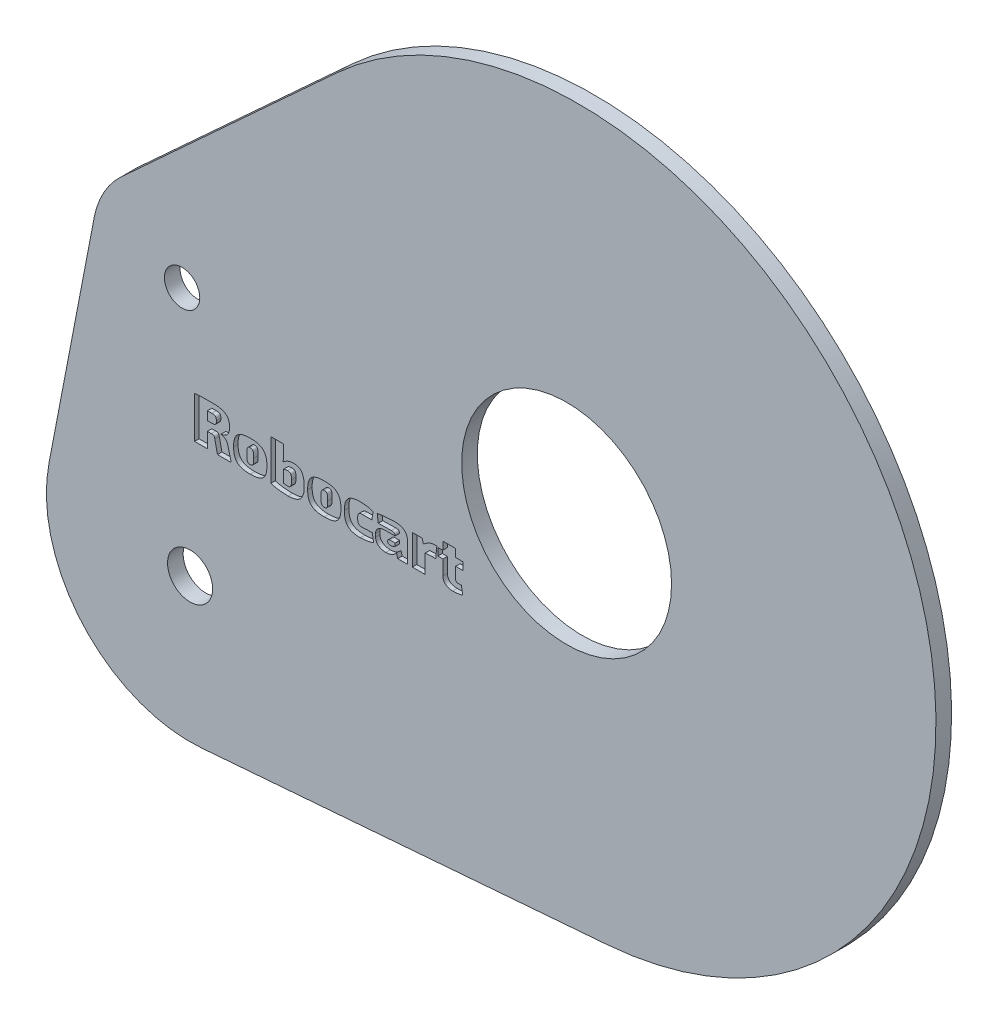
from build123d import *

# Parameters (mm, degrees)
SKETCH1_R           = 5.0254
SKETCH1_R_2         = 3.175
BOSS_EXTRUDE1_DEPTH = 4.445
SKETCH2_R           = 6.4135
BOSS_EXTRUDE2_DEPTH = 4.445
CUT_EXTRUDE5_DEPTH  = 1.27
SKETCH7_R           = 29.845
CUT_EXTRUDE8_DEPTH  = 242.323003135


with BuildPart() as part:
    # Sketch1 → Boss-Extrude1 (new body)
    with BuildSketch(Plane.XY):
        with BuildLine():
            Line((-17.211015945, 18.751241343), (43.963752379, 74.901119305))
            ThreePointArc((43.963752379, 74.901119305), (214.381413502, 0), (43.963752379, -74.901119305))
            Line((43.963752379, -74.901119305), (-17.211015945, -18.751241343))
            ThreePointArc((-17.211015945, -18.751241343), (-25.452467891, 0), (-17.211015945, 18.751241343))
        make_face()
        Circle(SKETCH1_R, mode=Mode.SUBTRACT)
        with Locations((112.7125, 0)):
            Circle(SKETCH1_R_2, mode=Mode.SUBTRACT)
    extrude(amount=BOSS_EXTRUDE1_DEPTH)

    # Sketch2 → Boss-Extrude2 (add)
    with BuildSketch(Plane.XY):
        with BuildLine():
            Line((-24.995388267, 4.801946178), (-37.855905828, -62.140417979))
            ThreePointArc((-37.855905828, -62.140417979), (-28.163364792, -97.115789925), (5.538841954, -110.583650001))
            Line((5.538841954, -110.583650001), (120.834104773, -101.344005785))
            ThreePointArc((120.834104773, -101.344005785), (79.641074663, -96.139735796), (43.963752379, -74.901119305))
            Line((43.963752379, -74.901119305), (-17.211015945, -18.751241343))
            ThreePointArc((-17.211015945, -18.751241343), (-24.166780914, -7.987166081), (-24.995388267, 4.801946178))
        make_face()
        with Locations((2.274488984, -69.85)):
            Circle(SKETCH2_R, mode=Mode.SUBTRACT)
    extrude(amount=BOSS_EXTRUDE2_DEPTH)

    # Sketch5 → Cut-Extrude5 (cut)
    # profile 1 of 8: a face of its own
    with BuildSketch(Plane.XY.offset(4.445)):
        with BuildLine():
            Line((13.963704332, -36.057605806), (13.037614354, -32.449309188))
            add(Edge.make_bspline(
                [(13.037614354, -32.449309188), (13.014990571, -32.365644285), (12.971064629, -32.203201971), (12.896536125, -31.970161677), (12.806221588, -31.759183753), (12.708280407, -31.566790267), (12.596656769, -31.39709784), (12.478234261, -31.245551793), (12.345653753, -31.11867894), (12.160105674, -30.980245842), (11.921747748, -30.846153242), (11.640556459, -30.716510915), (11.365581075, -30.628104271), (11.181578474, -30.606425076), (11.092818152, -30.59596733)],
                knots=[0, 0, 0, 0, 1.077305702, 2.091677954, 3.037688743, 3.926929695, 4.771153773, 5.558605575, 6.312393956, 7.044123723, 8.430977119, 9.701515358, 10.89124264, 12, 12, 12, 12], degree=3))
            Line((11.092818152, -30.59596733), (11.093852026, -30.490707873))
            add(Edge.make_bspline(
                [(11.093852026, -30.490707873), (11.202590701, -30.475351692), (11.413544088, -30.445560652), (11.716001273, -30.377632832), (11.991876474, -30.285100292), (12.242847632, -30.176293564), (12.471067847, -30.051620567), (12.669266098, -29.90083579), (12.845338876, -29.735309335), (12.99145185, -29.547434621), (13.112604312, -29.345503098), (13.224948415, -29.137740289), (13.311060145, -28.916416469), (13.388184538, -28.68792999), (13.440911923, -28.448026662), (13.477314381, -28.199186394), (13.501750709, -27.941486191), (13.500324263, -27.766261913), (13.499598898, -27.677158204)],
                knots=[0, 0, 0, 0, 1.26978194, 2.463381128, 3.579096605, 4.629624065, 5.624356077, 6.577924219, 7.501901734, 8.4118476, 9.319542298, 10.223774319, 11.139249399, 12.061995962, 13.010448794, 13.974684905, 14.970102261, 16, 16, 16, 16], degree=3))
            add(Edge.make_bspline(
                [(13.499598898, -27.677158204), (13.497779323, -27.51291216), (13.494275187, -27.196607345), (13.438886003, -26.74186203), (13.348357528, -26.325529583), (13.221174047, -25.946373662), (13.052132351, -25.606658347), (12.844529179, -25.306163557), (12.600414942, -25.042265619), (12.312565127, -24.820638192), (11.985902071, -24.631404835), (11.617145926, -24.470697822), (11.204967827, -24.340580285), (10.75300819, -24.226744159), (10.256133309, -24.148648607), (9.717084542, -24.091653462), (9.134898017, -24.062842929), (8.733060441, -24.063128866), (8.525255548, -24.063276735)],
                knots=[0, 0, 0, 0, 1.104208727, 2.126483719, 3.075171058, 3.966171587, 4.809496057, 5.618738063, 6.415337279, 7.217477855, 8.052665404, 8.949189943, 9.917359153, 10.957177015, 12.081428767, 13.297225691, 14.602296653, 16, 16, 16, 16], degree=3))
            add(Edge.make_bspline(
                [(8.525255548, -24.063276735), (8.256459134, -24.062794687), (7.743596603, -24.06187494), (7.013077477, -24.068064036), (6.359145049, -24.073281532), (5.587169315, -24.093866835), (4.661777333, -24.134626761), (3.930813591, -24.200571992), (3.560806466, -24.233952862)],
                knots=[0, 0, 0, 0, 0.973558164, 1.857545264, 2.645999097, 3.342055079, 4.654572721, 6, 6, 6, 6], degree=3))
            Line((3.560806466, -24.233952862), (3.563277617, -36.057605806))
            Line((3.563277617, -36.057605806), (7.184582203, -36.057605806))
            Line((7.184582203, -36.057605806), (7.184582203, -31.768440531))
            Line((7.184582203, -31.768440531), (8.30891747, -31.768440531))
            add(Edge.make_bspline(
                [(8.30891747, -31.768440531), (8.380261755, -31.769369764), (8.513302565, -31.771102573), (8.700281908, -31.796279287), (8.856873741, -31.847706403), (8.99055896, -31.921151927), (9.095389594, -32.032855265), (9.182529606, -32.177565891), (9.249964241, -32.360968219), (9.280570623, -32.496879584), (9.297008469, -32.569873841)],
                knots=[0, 0, 0, 0, 1.193247076, 2.225133473, 3.141087189, 3.938333415, 4.747893053, 5.670469204, 6.74887306, 8, 8, 8, 8], degree=3))
            Line((9.297008469, -32.569873841), (10.061765834, -36.057605806))
            Line((10.061765834, -36.057605806), (13.963704332, -36.057605806))
        make_face()
        with BuildLine():
            Line((7.184582203, -29.126668499), (7.184582203, -26.702577615))
            Line((7.184582203, -26.702577615), (8.443166457, -26.702577615))
            add(Edge.make_bspline(
                [(8.443166457, -26.702577615), (8.55974947, -26.702835759), (8.774857139, -26.703312062), (9.069245607, -26.746786171), (9.307824191, -26.818815143), (9.495289883, -26.934320456), (9.622357546, -27.10757662), (9.705012968, -27.329239872), (9.749194089, -27.60532945), (9.749503166, -27.807276716), (9.749671241, -27.917094208)],
                knots=[0, 0, 0, 0, 1.314294372, 2.425008512, 3.346034536, 4.11257004, 4.862605474, 5.723121957, 6.761849854, 8, 8, 8, 8], degree=3))
            add(Edge.make_bspline(
                [(9.749671241, -27.917094208), (9.749462678, -28.026085366), (9.749077821, -28.227205123), (9.705009978, -28.502474206), (9.622358211, -28.724139888), (9.495289599, -28.897389134), (9.307824756, -29.012921602), (9.069243039, -29.084819613), (8.774224153, -29.129036801), (8.558415428, -29.127502287), (8.441154268, -29.126668499)],
                knots=[0, 0, 0, 0, 1.229150822, 2.268133684, 3.128861388, 3.879080924, 4.645804581, 5.567056679, 6.678043453, 8, 8, 8, 8], degree=3))
            Line((8.441154268, -29.126668499), (7.184582203, -29.126668499))
        make_face(mode=Mode.SUBTRACT)
    # profile 2 of 8: a face of its own
    with BuildSketch(Plane.XY.offset(4.445)):
        with BuildLine():
            add(Edge.make_bspline(
                [(19.392408615, -27.370438305), (19.185940731, -27.37121647), (18.788443795, -27.372714613), (18.214825083, -27.415394013), (17.686058795, -27.487157041), (17.20268726, -27.59542077), (16.76459492, -27.735119832), (16.372638511, -27.908622648), (16.024579804, -28.114088335), (15.720673057, -28.356552609), (15.458507791, -28.639434381), (15.234998101, -28.964856165), (15.046260918, -29.333899032), (14.896720781, -29.748269807), (14.781171023, -30.20574699), (14.701460929, -30.707355794), (14.653402971, -31.252980669), (14.652664325, -31.631462891), (14.652281146, -31.827803724)],
                knots=[0, 0, 0, 0, 1.301138732, 2.504983567, 3.622955002, 4.661926955, 5.623444867, 6.516867694, 7.358299959, 8.164315082, 8.958683684, 9.780463849, 10.645170289, 11.564345272, 12.55137133, 13.615162501, 14.76284551, 16, 16, 16, 16], degree=3))
            add(Edge.make_bspline(
                [(14.652281146, -31.827803724), (14.652683844, -32.020846667), (14.653461359, -32.393566713), (14.701421784, -32.930979582), (14.781161162, -33.425184288), (14.896568533, -33.875369171), (15.046865454, -34.282830679), (15.23482084, -34.646579128), (15.459495784, -34.966867972), (15.719799454, -35.24761051), (16.026355063, -35.483959428), (16.371844156, -35.690792822), (16.764905901, -35.860835683), (17.202769513, -35.998315896), (17.686174729, -36.104237626), (18.215025172, -36.172549933), (18.788142548, -36.21690631), (19.185414172, -36.216251559), (19.391635626, -36.215911682)],
                knots=[0, 0, 0, 0, 1.225303258, 2.365769401, 3.421876917, 4.400943223, 5.312143672, 6.173900677, 6.993129972, 7.789505327, 8.594933318, 9.442546689, 10.340413257, 11.307394121, 12.352858382, 13.478324105, 14.691012305, 16, 16, 16, 16], degree=3))
            add(Edge.make_bspline(
                [(19.391635626, -36.215911682), (19.597032745, -36.216251945), (19.992657844, -36.216907342), (20.563309426, -36.172565441), (21.089688433, -36.104227613), (21.570666185, -35.998406236), (22.00669053, -35.860378726), (22.398966428, -35.690697968), (22.744357702, -35.48476242), (23.048799976, -35.246752683), (23.30884749, -34.966889154), (23.53405161, -34.647213564), (23.718480818, -34.282096079), (23.869607615, -33.875481435), (23.984729298, -33.425150679), (24.064554181, -32.930989632), (24.112489404, -32.393563896), (24.113270555, -32.020845706), (24.113675136, -31.827803724)],
                knots=[0, 0, 0, 0, 1.306386535, 2.516292846, 3.638834432, 4.681288433, 5.645225056, 6.544905627, 7.394231473, 8.197166916, 8.995151228, 9.816035651, 10.677123946, 11.590165338, 12.571209699, 13.62945092, 14.772221202, 16, 16, 16, 16], degree=3))
            add(Edge.make_bspline(
                [(24.113675136, -31.827803724), (24.113290046, -31.631463854), (24.112547717, -31.252983486), (24.064515237, -30.707345781), (23.984718669, -30.205780525), (23.869458196, -29.748157657), (23.719073032, -29.334629822), (23.533881557, -28.964226762), (23.309838836, -28.639410514), (23.047913464, -28.357409293), (22.746143109, -28.113290896), (22.398170175, -27.908717581), (22.006996305, -27.735582548), (21.570750122, -27.595337595), (21.089805172, -27.487132059), (20.563508471, -27.415524751), (19.992633712, -27.372122206), (19.597024498, -27.372640416), (19.391635626, -27.372909456)],
                knots=[0, 0, 0, 0, 1.239761575, 2.389863124, 3.455896047, 4.445002089, 5.366114071, 6.230275951, 7.053787873, 7.849830466, 8.653486971, 9.496692405, 10.391997964, 11.35058848, 12.386669903, 13.50184006, 14.703027546, 16, 16, 16, 16], degree=3))
            Line((19.391635626, -27.372909456), (19.392408615, -27.370438305))
        make_face()
        with BuildLine():
            add(Edge.make_bspline(
                [(19.392408615, -29.725274142), (19.437531289, -29.724140714), (19.525024289, -29.721942995), (19.65102649, -29.737238192), (19.76620368, -29.76483225), (19.87182592, -29.802109335), (19.962537582, -29.861963333), (20.042092672, -29.933543699), (20.109942403, -30.020017857), (20.16833225, -30.121266804), (20.214599448, -30.244431568), (20.257437224, -30.390375107), (20.286756888, -30.564903306), (20.314974666, -30.765182064), (20.332768493, -30.993196759), (20.349156064, -31.24710558), (20.352028087, -31.528505382), (20.351602926, -31.724744581), (20.351379644, -31.827803724)],
                knots=[0, 0, 0, 0, 0.815282387, 1.580835021, 2.285938702, 2.955970902, 3.59284183, 4.236654335, 4.883909712, 5.571782011, 6.34138828, 7.256745613, 8.318150629, 9.536784446, 10.913497992, 12.451627213, 14.136497401, 16, 16, 16, 16], degree=3))
            add(Edge.make_bspline(
                [(20.351379644, -31.827803724), (20.35159955, -31.927564515), (20.352019405, -32.118031924), (20.34917368, -32.391195088), (20.332779722, -32.637680018), (20.315073621, -32.858305107), (20.286553348, -33.051939542), (20.257596079, -33.220793633), (20.214257509, -33.362529917), (20.155693628, -33.514911844), (20.051090018, -33.669923267), (19.870735609, -33.798425844), (19.643452754, -33.865218315), (19.479445068, -33.862520337), (19.391635626, -33.861075845)],
                knots=[0, 0, 0, 0, 1.385054146, 2.644402385, 3.791133793, 4.814000026, 5.715679688, 6.508153822, 7.189017703, 7.76931152, 8.772713745, 9.732124418, 10.785783184, 12, 12, 12, 12], degree=3))
            add(Edge.make_bspline(
                [(19.391635626, -33.861075845), (19.301306425, -33.86271431), (19.133954745, -33.865749872), (18.902525901, -33.797741478), (18.717735707, -33.671072511), (18.610582928, -33.515364885), (18.551006939, -33.362942633), (18.512459098, -33.219990413), (18.478046172, -33.052393011), (18.451529414, -32.858200063), (18.432071348, -32.637802884), (18.421098431, -32.391048348), (18.412685119, -32.118090951), (18.413926504, -31.927578365), (18.414576639, -31.827803724)],
                knots=[0, 0, 0, 0, 1.241376632, 2.299881571, 3.272351116, 4.276537072, 4.853504633, 5.527301281, 6.317449116, 7.213960333, 8.230963477, 9.370496789, 10.622885011, 12, 12, 12, 12], degree=3))
            add(Edge.make_bspline(
                [(18.414576639, -31.827803724), (18.413920098, -31.724731001), (18.412669836, -31.528447706), (18.421114928, -31.247248307), (18.432075612, -30.993076145), (18.451640516, -30.765288151), (18.477809436, -30.564450024), (18.512677464, -30.391184595), (18.550528138, -30.243947504), (18.597992213, -30.121472778), (18.655635922, -30.019044712), (18.726640856, -29.934548542), (18.806324672, -29.86014789), (18.90084365, -29.803586909), (19.007720237, -29.76410688), (19.124926082, -29.737543648), (19.254377699, -29.721206538), (19.344600366, -29.725504607), (19.391635626, -29.727745294)],
                knots=[0, 0, 0, 0, 1.852277897, 3.527327117, 5.055401374, 6.423822364, 7.635115809, 8.692933536, 9.598786439, 10.363757028, 11.047485967, 11.700160994, 12.340095531, 12.998298253, 13.664294552, 14.379571275, 15.155231305, 16, 16, 16, 16], degree=3))
            Line((19.391635626, -29.727745294), (19.392408615, -29.725274142))
        make_face(mode=Mode.SUBTRACT)
    # profile 3 of 8: a face of its own
    with BuildSketch(Plane.XY.offset(4.445)):
        with BuildLine():
            Line((28.85797675, -24.045964181), (25.266354969, -24.045964181))
            Line((25.266354969, -24.045964181), (25.266354969, -35.514452512))
            add(Edge.make_bspline(
                [(25.266354969, -35.514452512), (25.33774682, -35.545467337), (25.486176503, -35.609949777), (25.724338862, -35.693194207), (25.98408074, -35.76865646), (26.262717846, -35.840498934), (26.56136332, -35.905161356), (26.880959563, -35.960891414), (27.220596376, -36.013233723), (27.692261258, -36.070319552), (28.271926605, -36.127474027), (28.937324543, -36.180717163), (29.553550952, -36.21253418), (29.947962267, -36.21481811), (30.136810918, -36.215911682)],
                knots=[0, 0, 0, 0, 0.566143425, 1.17705996, 1.833791331, 2.533600597, 3.270136108, 4.056160048, 4.893498106, 5.769972827, 7.512277332, 9.130813025, 10.626200442, 12, 12, 12, 12], degree=3))
            add(Edge.make_bspline(
                [(30.136810918, -36.215911682), (30.253120421, -36.212831969), (30.481025042, -36.206797375), (30.814116882, -36.180351265), (31.132628194, -36.148829369), (31.435926278, -36.108441573), (31.724065643, -36.051908895), (31.997843415, -35.992040435), (32.256210542, -35.91986874), (32.499003227, -35.838292685), (32.727794574, -35.747533842), (32.939448091, -35.643456076), (33.136885285, -35.531157057), (33.320096393, -35.411444435), (33.486668107, -35.278254108), (33.640625141, -35.138671251), (33.777483607, -34.986492799), (33.937767113, -34.771179967), (34.113879784, -34.488036121), (34.294341823, -34.133196268), (34.447119214, -33.765794756), (34.564998476, -33.382831094), (34.65496768, -32.986863978), (34.710398877, -32.576353497), (34.739719244, -32.153036178), (34.731776168, -31.866585988), (34.727751374, -31.721440341)],
                knots=[0, 0, 0, 0, 1.127999254, 2.210277188, 3.238897676, 4.23162696, 5.17557524, 6.085246793, 6.948444366, 7.775179884, 8.56797293, 9.333154585, 10.060037587, 10.769610838, 11.452607753, 12.125943687, 12.782602808, 13.433395291, 14.726629494, 16.010264116, 17.290083694, 18.579729525, 19.890904527, 21.222829017, 22.592794515, 24, 24, 24, 24], degree=3))
            add(Edge.make_bspline(
                [(34.727751374, -31.721440341), (34.727933299, -31.536718239), (34.728284429, -31.180190099), (34.699184003, -30.664769561), (34.643331299, -30.188802796), (34.573863297, -29.750232724), (34.469587637, -29.352865417), (34.352130307, -28.992447141), (34.204755582, -28.672388477), (34.034267402, -28.389214863), (33.833226005, -28.142238077), (33.601722543, -27.930169453), (33.337174347, -27.753584651), (33.044251025, -27.605258106), (32.715597337, -27.499208813), (32.358146924, -27.419103488), (31.968334791, -27.375581811), (31.698556174, -27.372189381), (31.559111975, -27.370435889)],
                knots=[0, 0, 0, 0, 1.421889281, 2.744357793, 3.971045822, 5.110570847, 6.158979495, 7.130494519, 8.025127154, 8.865537539, 9.668536019, 10.468266483, 11.27281888, 12.110227575, 12.987396072, 13.923728139, 14.926808692, 16, 16, 16, 16], degree=3))
            add(Edge.make_bspline(
                [(31.559111975, -27.370435889), (31.418641204, -27.377290653), (31.140084953, -27.390883782), (30.728616209, -27.464875676), (30.329554514, -27.580548152), (29.947501678, -27.741160167), (29.584829673, -27.927749873), (29.24432769, -28.134731264), (28.925819878, -28.355544927), (28.731396999, -28.52069247), (28.635355715, -28.602272283)],
                knots=[0, 0, 0, 0, 1.041431214, 2.065178201, 3.090091768, 4.114841366, 5.131524032, 6.110368693, 7.066557293, 8, 8, 8, 8], degree=3))
            add(Edge.make_bspline(
                [(28.635355715, -28.602272283), (28.679442374, -28.437175357), (28.767969322, -28.105657221), (28.849479342, -27.592991808), (28.896352505, -27.067100389), (28.893865391, -26.71174055), (28.892606689, -26.531896657)],
                knots=[0, 0, 0, 0, 0.978525379, 1.96489976, 2.970057081, 4, 4, 4, 4], degree=3))
            Line((28.892606689, -26.531896657), (28.85797675, -24.045964181))
        make_face()
        with BuildLine():
            add(Edge.make_bspline(
                [(28.85797675, -30.2598859), (28.938164933, -30.228940975), (29.104665913, -30.164687614), (29.377050817, -30.104325797), (29.674368967, -30.057331397), (29.8826484, -30.048796574), (29.990870462, -30.044361877)],
                knots=[0, 0, 0, 0, 0.888373905, 1.844600052, 2.880053484, 4, 4, 4, 4], degree=3))
            add(Edge.make_bspline(
                [(29.990870462, -30.044361877), (30.090154356, -30.043598185), (30.274287887, -30.04218183), (30.527813382, -30.099026489), (30.737205354, -30.19921343), (30.864952608, -30.333576514), (30.941281231, -30.464225448), (30.989420661, -30.585258272), (31.027872641, -30.727413399), (31.060247012, -30.890209447), (31.083691262, -31.0745416), (31.101568749, -31.280805556), (31.107864209, -31.508677969), (31.10693523, -31.667848007), (31.106449204, -31.751123146)],
                knots=[0, 0, 0, 0, 1.480574637, 2.745897867, 3.854410053, 4.900898594, 5.459220732, 6.111846885, 6.841895749, 7.659301981, 8.592332102, 9.619461279, 10.75454141, 12, 12, 12, 12], degree=3))
            add(Edge.make_bspline(
                [(31.106449204, -31.751123146), (31.10587886, -31.85088874), (31.104785136, -32.042205133), (31.099203337, -32.316196797), (31.08137277, -32.564522478), (31.057260162, -32.7874112), (31.026051856, -32.984988562), (30.98671092, -33.156994563), (30.941202348, -33.303431436), (30.870052532, -33.460932897), (30.752629333, -33.623379885), (30.561916019, -33.764163367), (30.326364118, -33.848483391), (30.155689552, -33.856708884), (30.065077473, -33.861075845)],
                knots=[0, 0, 0, 0, 1.341428161, 2.572401811, 3.683694972, 4.687557271, 5.586054722, 6.371270954, 7.058412011, 7.643759289, 8.690296819, 9.712417619, 10.785509759, 12, 12, 12, 12], degree=3))
            add(Edge.make_bspline(
                [(30.065077473, -33.861075845), (29.981058258, -33.848086833), (29.796152635, -33.819501215), (29.501179908, -33.788497905), (29.182666077, -33.755491625), (28.965965097, -33.730208343), (28.85797675, -33.717608955)],
                knots=[0, 0, 0, 0, 0.839061258, 1.84656741, 2.926882437, 4, 4, 4, 4], degree=3))
            Line((28.85797675, -33.717608955), (28.85797675, -30.2598859))
        make_face(mode=Mode.SUBTRACT)
    # profile 4 of 8: a face of its own
    with BuildSketch(Plane.XY.offset(4.445)):
        with BuildLine():
            add(Edge.make_bspline(
                [(40.447411398, -27.370438305), (40.240943513, -27.37121647), (39.843446578, -27.372714613), (39.269827865, -27.415394013), (38.741061578, -27.487157041), (38.257690043, -27.59542077), (37.819597703, -27.735119832), (37.427641293, -27.908622648), (37.079582586, -28.114088335), (36.775675839, -28.356552609), (36.513510574, -28.639434381), (36.290000883, -28.964856165), (36.101263701, -29.333899032), (35.951723564, -29.748269807), (35.836173805, -30.20574699), (35.756463711, -30.707355794), (35.708405753, -31.252980669), (35.707667107, -31.631462891), (35.707283928, -31.827803724)],
                knots=[0, 0, 0, 0, 1.301138732, 2.504983567, 3.622955002, 4.661926955, 5.623444867, 6.516867694, 7.358299959, 8.164315082, 8.958683684, 9.780463849, 10.645170289, 11.564345272, 12.55137133, 13.615162501, 14.76284551, 16, 16, 16, 16], degree=3))
            add(Edge.make_bspline(
                [(35.707283928, -31.827803724), (35.707686627, -32.020846667), (35.708464141, -32.393566713), (35.756424567, -32.930979582), (35.836163945, -33.425184288), (35.951571315, -33.875369171), (36.101868237, -34.282830679), (36.289823623, -34.646579128), (36.514498566, -34.966867972), (36.774802237, -35.24761051), (37.081357845, -35.483959428), (37.426846938, -35.690792822), (37.819908684, -35.860835683), (38.257772296, -35.998315896), (38.741177511, -36.104237626), (39.270027954, -36.172549933), (39.84314533, -36.21690631), (40.240416955, -36.216251559), (40.446638408, -36.215911682)],
                knots=[0, 0, 0, 0, 1.225303258, 2.365769401, 3.421876917, 4.400943223, 5.312143672, 6.173900677, 6.993129972, 7.789505327, 8.594933318, 9.442546689, 10.340413257, 11.307394121, 12.352858382, 13.478324105, 14.691012305, 16, 16, 16, 16], degree=3))
            add(Edge.make_bspline(
                [(40.446638408, -36.215911682), (40.652035527, -36.216251945), (41.047660626, -36.216907342), (41.618312209, -36.172565441), (42.144691215, -36.104227613), (42.625668967, -35.998406236), (43.061693313, -35.860378726), (43.45396921, -35.690697968), (43.799360485, -35.48476242), (44.103802758, -35.246752683), (44.363850273, -34.966889154), (44.589054393, -34.647213564), (44.7734836, -34.282096079), (44.924610397, -33.875481435), (45.039732081, -33.425150679), (45.119556963, -32.930989632), (45.167492187, -32.393563896), (45.168273337, -32.020845706), (45.168677918, -31.827803724)],
                knots=[0, 0, 0, 0, 1.306386535, 2.516292846, 3.638834432, 4.681288433, 5.645225056, 6.544905627, 7.394231473, 8.197166916, 8.995151228, 9.816035651, 10.677123946, 11.590165338, 12.571209699, 13.62945092, 14.772221202, 16, 16, 16, 16], degree=3))
            add(Edge.make_bspline(
                [(45.168677918, -31.827803724), (45.168292829, -31.631463854), (45.167550499, -31.252983486), (45.119518019, -30.707345781), (45.039721451, -30.205780525), (44.924460978, -29.748157657), (44.774075814, -29.334629822), (44.588884339, -28.964226762), (44.364841618, -28.639410514), (44.102916246, -28.357409293), (43.801145891, -28.113290896), (43.453172958, -27.908717581), (43.061999088, -27.735582548), (42.625752905, -27.595337595), (42.144807955, -27.487132059), (41.618511254, -27.415524751), (41.047636495, -27.372122206), (40.652027281, -27.372640416), (40.446638408, -27.372909456)],
                knots=[0, 0, 0, 0, 1.239761575, 2.389863124, 3.455896047, 4.445002089, 5.366114071, 6.230275951, 7.053787873, 7.849830466, 8.653486971, 9.496692405, 10.391997964, 11.35058848, 12.386669903, 13.50184006, 14.703027546, 16, 16, 16, 16], degree=3))
            Line((40.446638408, -27.372909456), (40.447411398, -27.370438305))
        make_face()
        with BuildLine():
            add(Edge.make_bspline(
                [(40.447411398, -29.725274142), (40.492534071, -29.724140714), (40.580027071, -29.721942995), (40.706029272, -29.737238192), (40.821206463, -29.76483225), (40.926828703, -29.802109335), (41.017540364, -29.861963333), (41.097095455, -29.933543699), (41.164945186, -30.020017857), (41.223335033, -30.121266804), (41.26960223, -30.244431568), (41.312440007, -30.390375107), (41.341759671, -30.564903306), (41.369977448, -30.765182064), (41.387771276, -30.993196759), (41.404158847, -31.24710558), (41.407030869, -31.528505382), (41.406605708, -31.724744581), (41.406382426, -31.827803724)],
                knots=[0, 0, 0, 0, 0.815282387, 1.580835021, 2.285938702, 2.955970902, 3.59284183, 4.236654335, 4.883909712, 5.571782011, 6.34138828, 7.256745613, 8.318150629, 9.536784446, 10.913497992, 12.451627213, 14.136497401, 16, 16, 16, 16], degree=3))
            add(Edge.make_bspline(
                [(41.406382426, -31.827803724), (41.406602333, -31.927564515), (41.407022188, -32.118031924), (41.404176462, -32.391195088), (41.387782505, -32.637680018), (41.370076403, -32.858305107), (41.34155613, -33.051939542), (41.312598861, -33.220793633), (41.269260291, -33.362529917), (41.210696411, -33.514911844), (41.1060928, -33.669923267), (40.925738391, -33.798425844), (40.698455536, -33.865218315), (40.53444785, -33.862520337), (40.446638408, -33.861075845)],
                knots=[0, 0, 0, 0, 1.385054146, 2.644402385, 3.791133793, 4.814000026, 5.715679688, 6.508153822, 7.189017703, 7.76931152, 8.772713745, 9.732124418, 10.785783184, 12, 12, 12, 12], degree=3))
            add(Edge.make_bspline(
                [(40.446638408, -33.861075845), (40.356309207, -33.86271431), (40.188957528, -33.865749872), (39.957528684, -33.797741478), (39.77273849, -33.671072511), (39.665585711, -33.515364885), (39.606009722, -33.362942633), (39.56746188, -33.219990413), (39.533048954, -33.052393011), (39.506532197, -32.858200063), (39.48707413, -32.637802884), (39.476101213, -32.391048348), (39.467687902, -32.118090951), (39.468929287, -31.927578365), (39.469579421, -31.827803724)],
                knots=[0, 0, 0, 0, 1.241376632, 2.299881571, 3.272351116, 4.276537072, 4.853504633, 5.527301281, 6.317449116, 7.213960333, 8.230963477, 9.370496789, 10.622885011, 12, 12, 12, 12], degree=3))
            add(Edge.make_bspline(
                [(39.469579421, -31.827803724), (39.46892288, -31.724731001), (39.467672618, -31.528447706), (39.47611771, -31.247248307), (39.487078394, -30.993076145), (39.506643298, -30.765288151), (39.532812219, -30.564450024), (39.567680246, -30.391184595), (39.60553092, -30.243947504), (39.652994995, -30.121472778), (39.710638704, -30.019044712), (39.781643638, -29.934548542), (39.861327454, -29.86014789), (39.955846432, -29.803586909), (40.062723019, -29.76410688), (40.179928865, -29.737543648), (40.309380481, -29.721206538), (40.399603149, -29.725504607), (40.446638408, -29.727745294)],
                knots=[0, 0, 0, 0, 1.852277897, 3.527327117, 5.055401374, 6.423822364, 7.635115809, 8.692933536, 9.598786439, 10.363757028, 11.047485967, 11.700160994, 12.340095531, 12.998298253, 13.664294552, 14.379571275, 15.155231305, 16, 16, 16, 16], degree=3))
            Line((40.446638408, -29.727745294), (40.447411398, -29.725274142))
        make_face(mode=Mode.SUBTRACT)
    # profile 5 of 8: a face of its own
    with BuildSketch(Plane.XY.offset(4.445)):
        with BuildLine():
            add(Edge.make_bspline(
                [(54.107651647, -33.27059384), (53.84002184, -33.295782752), (53.320082329, -33.34471867), (52.68112121, -33.37225006), (52.205166116, -33.380840506), (51.889380831, -33.387333455), (51.609020319, -33.38591113), (51.434222733, -33.386074622), (51.352595559, -33.38615097)],
                knots=[0, 0, 0, 0, 1.753605035, 3.406827339, 4.170886547, 4.859546372, 5.467429674, 6, 6, 6, 6], degree=3))
            add(Edge.make_bspline(
                [(51.352595559, -33.38615097), (51.288257908, -33.38713718), (51.16356574, -33.389048545), (50.984334545, -33.375792096), (50.819386497, -33.355069779), (50.670634076, -33.31978455), (50.535596795, -33.276326421), (50.416645239, -33.219662393), (50.312693678, -33.151350016), (50.22172405, -33.072044846), (50.145642956, -32.974241984), (50.082316443, -32.85944643), (50.026729874, -32.727142095), (49.987082558, -32.574337651), (49.951236144, -32.404602196), (49.930675405, -32.214941417), (49.918001023, -32.006911113), (49.917952178, -31.861632316), (49.917926666, -31.785753084)],
                knots=[0, 0, 0, 0, 1.209474384, 2.344070404, 3.376943074, 4.332298939, 5.214920591, 6.040246273, 6.80146698, 7.548338784, 8.299063779, 9.118395519, 10.008206862, 10.990122684, 12.081843351, 13.268539912, 14.5733562, 16, 16, 16, 16], degree=3))
            add(Edge.make_bspline(
                [(49.917926666, -31.785753084), (49.917954701, -31.711522008), (49.918008636, -31.568713514), (49.930838903, -31.363172194), (49.951019745, -31.17511603), (49.986940058, -31.006982105), (50.027327574, -30.856121136), (50.081545611, -30.724818417), (50.146419747, -30.611726083), (50.221636998, -30.514251149), (50.312719782, -30.435022254), (50.416628092, -30.366635916), (50.535641772, -30.310212928), (50.670283042, -30.265828251), (50.819778089, -30.234668666), (50.984269823, -30.212741839), (51.163583844, -30.199852929), (51.28826407, -30.201711301), (51.352595559, -30.202670168)],
                knots=[0, 0, 0, 0, 1.403834989, 2.700749752, 3.89441997, 4.977274868, 5.949945309, 6.844985653, 7.655590205, 8.410726857, 9.161987675, 9.927681717, 10.757857448, 11.645665852, 12.603212224, 13.6421546, 14.783418105, 16, 16, 16, 16], degree=3))
            Line((51.352595559, -30.202670168), (53.953773553, -30.200199017))
            Line((53.953773553, -30.200199017), (54.31282244, -27.997299137))
            add(Edge.make_bspline(
                [(54.31282244, -27.997299137), (54.176091179, -27.940521737), (53.899388106, -27.825621304), (53.463544379, -27.688107836), (53.006733558, -27.576308959), (52.53319341, -27.498107556), (52.05997885, -27.440868548), (51.600631964, -27.397572295), (51.162379139, -27.374638478), (50.877693617, -27.373475447), (50.739150929, -27.372909456)],
                knots=[0, 0, 0, 0, 0.972227876, 1.967497694, 2.99880285, 4.059393783, 5.118240435, 6.129942292, 7.08993327, 8, 8, 8, 8], degree=3))
            add(Edge.make_bspline(
                [(50.739150929, -27.372909456), (50.538710802, -27.373727885), (50.151351778, -27.375309535), (49.592801842, -27.41775067), (49.078690327, -27.489141999), (48.610409709, -27.598614086), (48.186003206, -27.737439815), (47.80638156, -27.911148074), (47.470403928, -28.116596428), (47.17901495, -28.360181325), (46.926681156, -28.642229141), (46.715089049, -28.96752477), (46.532420363, -29.332010202), (46.387709362, -29.741030277), (46.277384987, -30.192788829), (46.203090218, -30.687039468), (46.157286017, -31.222547083), (46.156195945, -31.593540143), (46.155631174, -31.785753084)],
                knots=[0, 0, 0, 0, 1.29163422, 2.49613777, 3.607763278, 4.633916918, 5.59188115, 6.481255239, 7.3189657, 8.122602918, 8.920579095, 9.748982409, 10.616508012, 11.542797806, 12.539191396, 13.609561865, 14.761504744, 16, 16, 16, 16], degree=3))
            add(Edge.make_bspline(
                [(46.155631174, -31.785753084), (46.156512407, -31.97876583), (46.158213235, -32.351291224), (46.199724288, -32.888711337), (46.274854845, -33.383727908), (46.386186609, -33.835645304), (46.527469838, -34.246640034), (46.706876122, -34.613377969), (46.917643699, -34.939039564), (47.165518097, -35.223782222), (47.456354992, -35.466695865), (47.788602702, -35.676495718), (48.167618016, -35.847431801), (48.589364996, -35.989059962), (49.055183832, -36.095653581), (49.565262301, -36.172218281), (50.120065282, -36.213254452), (50.504922359, -36.215004206), (50.70452099, -36.215911682)],
                knots=[0, 0, 0, 0, 1.24599968, 2.404849061, 3.477104633, 4.47525304, 5.406406521, 6.277870224, 7.104806972, 7.904649351, 8.705624952, 9.543120217, 10.434060644, 11.383616389, 12.411577258, 13.515407144, 14.711414278, 16, 16, 16, 16], degree=3))
            add(Edge.make_bspline(
                [(50.70452099, -36.215911682), (50.871122899, -36.215064216), (51.203778818, -36.21337207), (51.700505188, -36.181748666), (52.194156054, -36.133140456), (52.680617359, -36.062241759), (53.154267277, -35.968698142), (53.605032568, -35.841142282), (54.032328932, -35.690637154), (54.300405659, -35.563532687), (54.432186544, -35.501050803)],
                knots=[0, 0, 0, 0, 1.044018105, 2.084602774, 3.118183006, 4.152331538, 5.164818741, 6.141594537, 7.08644693, 8, 8, 8, 8], degree=3))
            Line((54.432186544, -35.501050803), (54.107651647, -33.27059384))
        make_face()
    # profile 6 of 8: a face of its own
    with BuildSketch(Plane.XY.offset(4.445)):
        with BuildLine():
            add(Edge.make_bspline(
                [(55.794293444, -30.10350042), (56.147433829, -30.090171174), (56.831061459, -30.064367721), (57.670043967, -30.047018702), (58.300006104, -30.036722069), (58.732885388, -30.031773937), (59.133609405, -30.029026223), (59.390039108, -30.029360381), (59.512893277, -30.029520474)],
                knots=[0, 0, 0, 0, 1.710120508, 3.310540727, 4.060769019, 4.759076525, 5.405479862, 6, 6, 6, 6], degree=3))
            add(Edge.make_bspline(
                [(59.512893277, -30.029520474), (59.602919853, -30.030569136), (59.768939341, -30.032502991), (59.996747486, -30.066972568), (60.183148407, -30.120594568), (60.32997743, -30.201803845), (60.440318251, -30.311124698), (60.514164063, -30.449040882), (60.559971388, -30.612897455), (60.564313447, -30.730847399), (60.566632843, -30.793852695)],
                knots=[0, 0, 0, 0, 1.437482754, 2.650885585, 3.672155217, 4.522178022, 5.304973306, 6.11909269, 6.995276142, 8, 8, 8, 8], degree=3))
            Line((60.566632843, -30.793852695), (60.569103995, -30.853218304))
            Line((60.569103995, -30.853218304), (57.814243569, -30.853218304))
            add(Edge.make_bspline(
                [(57.814243569, -30.853218304), (57.707610049, -30.856326567), (57.500014471, -30.862377776), (57.197823405, -30.888031185), (56.914551377, -30.935988282), (56.648312926, -30.998711748), (56.401070157, -31.084347258), (56.168682936, -31.181989552), (55.955776072, -31.301002528), (55.762255497, -31.437559429), (55.588228695, -31.588430399), (55.435500453, -31.754242444), (55.310186149, -31.93747146), (55.200225566, -32.131096878), (55.121868745, -32.342499913), (55.057021241, -32.565050111), (55.021057443, -32.802905788), (55.014398218, -32.966363367), (55.011001235, -33.04974585)],
                knots=[0, 0, 0, 0, 1.276297523, 2.484713259, 3.624839222, 4.711112875, 5.753076661, 6.751786018, 7.72337871, 8.664907758, 9.580869206, 10.474730127, 11.353216372, 12.231868772, 13.131373359, 14.043341815, 15.001875481, 16, 16, 16, 16], degree=3))
            Line((55.011001235, -33.04974585), (55.013472387, -33.893543828))
            add(Edge.make_bspline(
                [(55.013472387, -33.893543828), (55.018243269, -33.986773539), (55.027547251, -34.168586359), (55.071643973, -34.431888304), (55.144149748, -34.676476995), (55.240808843, -34.903408994), (55.36286412, -35.112897219), (55.510040414, -35.304792246), (55.682138505, -35.479144876), (55.878433139, -35.634288715), (56.092231358, -35.771022102), (56.31973565, -35.891120943), (56.558882515, -35.992138969), (56.810685679, -36.073804749), (57.073644614, -36.137942438), (57.348748194, -36.185324165), (57.63656642, -36.212260038), (57.832462076, -36.216317634), (57.932283928, -36.218385249)],
                knots=[0, 0, 0, 0, 1.069588051, 2.085867437, 3.051892561, 3.987710893, 4.906912752, 5.823827612, 6.752890775, 7.707986872, 8.685961382, 9.658439035, 10.65384439, 11.658185339, 12.689821465, 13.754278346, 14.855655614, 16, 16, 16, 16], degree=3))
            add(Edge.make_bspline(
                [(57.932283928, -36.218385249), (58.110780251, -36.210928209), (58.454132707, -36.196583975), (58.945007643, -36.110111178), (59.392451194, -35.982884929), (59.78991199, -35.797383264), (60.14577684, -35.585410244), (60.461384491, -35.350677324), (60.742530059, -35.102746691), (60.900130102, -34.916767834), (60.977244975, -34.825766996)],
                knots=[0, 0, 0, 0, 1.236914107, 2.379306714, 3.44609163, 4.451073934, 5.409537877, 6.312441219, 7.174264944, 8, 8, 8, 8], degree=3))
            Line((60.977244975, -34.825766996), (61.304507075, -36.057605806))
            Line((61.304507075, -36.057605806), (64.16072336, -36.057605806))
            Line((64.16072336, -36.057605806), (64.16072336, -30.807317209))
            add(Edge.make_bspline(
                [(64.16072336, -30.807317209), (64.156311271, -30.654277497), (64.14778587, -30.358561639), (64.100016777, -29.932478804), (64.028899622, -29.539953856), (63.92245898, -29.184099352), (63.786180432, -28.864166902), (63.620676371, -28.579382595), (63.422911733, -28.331370154), (63.19531694, -28.117914251), (62.935934457, -27.941562823), (62.655533297, -27.782187125), (62.344010518, -27.656792136), (62.009115848, -27.548291626), (61.645889762, -27.470960801), (61.256556358, -27.417137352), (60.840030917, -27.387132675), (60.553487045, -27.387540655), (60.405850985, -27.387750858)],
                knots=[0, 0, 0, 0, 1.248315083, 2.412096568, 3.49367279, 4.497923714, 5.434861739, 6.324149066, 7.175950841, 8.013401396, 8.858566588, 9.728650356, 10.639147673, 11.592001417, 12.597197689, 13.663379945, 14.796102749, 16, 16, 16, 16], degree=3))
            add(Edge.make_bspline(
                [(60.405850985, -27.387750858), (60.219479219, -27.389043689), (59.831740743, -27.391733367), (59.229854196, -27.419735906), (58.584781899, -27.455023113), (57.913732666, -27.510092949), (57.244842332, -27.572178857), (56.609594168, -27.64284885), (56.023103935, -27.723597486), (55.649857008, -27.78753005), (55.471084708, -27.818151526)],
                knots=[0, 0, 0, 0, 0.901990853, 1.876553333, 2.915875848, 4.028775225, 5.135100977, 6.167234853, 7.122169215, 8, 8, 8, 8], degree=3))
            Line((55.471084708, -27.818151526), (55.794293444, -30.10350042))
        make_face()
        with BuildLine():
            add(Edge.make_bspline(
                [(58.476468681, -33.09892732), (58.478851962, -33.059990923), (58.483361275, -32.986320898), (58.517160505, -32.883333955), (58.570333027, -32.793874803), (58.645984287, -32.717645626), (58.746324649, -32.661994729), (58.863558849, -32.617127137), (59.002052355, -32.587722366), (59.101309907, -32.580920663), (59.154226054, -32.577294542)],
                knots=[0, 0, 0, 0, 0.970557884, 1.836354356, 2.676567351, 3.549916996, 4.481944709, 5.517967931, 6.676780014, 8, 8, 8, 8], degree=3))
            Line((59.154226054, -32.577294542), (60.569103995, -32.574823391))
            Line((60.569103995, -32.574823391), (60.569103995, -33.448794539))
            add(Edge.make_bspline(
                [(60.569103995, -33.448794539), (60.454199938, -33.510091962), (60.233731743, -33.627704279), (59.890213939, -33.750585097), (59.557563199, -33.838445004), (59.334479535, -33.853669716), (59.225959499, -33.861075845)],
                knots=[0, 0, 0, 0, 1.100555499, 2.111652886, 3.08140519, 4, 4, 4, 4], degree=3))
            add(Edge.make_bspline(
                [(59.225959499, -33.861075845), (59.167258159, -33.8574937), (59.056530631, -33.85073675), (58.903138897, -33.820728485), (58.772050917, -33.780530628), (58.664676759, -33.723020937), (58.581215898, -33.650023838), (58.5185725, -33.563695427), (58.483613247, -33.461191104), (58.478902116, -33.388874587), (58.476468681, -33.351521031)],
                knots=[0, 0, 0, 0, 1.389617417, 2.621216174, 3.688168528, 4.622054161, 5.478836137, 6.29048019, 7.11698395, 8, 8, 8, 8], degree=3))
            Line((58.476468681, -33.351521031), (58.476468681, -33.09892732))
        make_face(mode=Mode.SUBTRACT)
    # profile 7 of 8: a face of its own
    with BuildSketch(Plane.XY.offset(4.445)):
        with BuildLine():
            Line((72.436503325, -27.381414758), (71.94067391, -27.381414758))
            add(Edge.make_bspline(
                [(71.94067391, -27.381414758), (71.799997791, -27.384981979), (71.517940482, -27.3921343), (71.097057888, -27.466649056), (70.676494042, -27.578430474), (70.259429607, -27.746546808), (69.839509386, -27.95297163), (69.423922566, -28.214154993), (69.006636866, -28.517553167), (68.741635326, -28.750134902), (68.605725776, -28.869417525)],
                knots=[0, 0, 0, 0, 0.902365574, 1.80925381, 2.736495937, 3.692065376, 4.691180146, 5.737204067, 6.839495137, 8, 8, 8, 8], degree=3))
            Line((68.605725776, -28.869417525), (68.281454179, -27.528744181))
            Line((68.281454179, -27.528744181), (65.476661034, -27.528744181))
            Line((65.476661034, -27.528744181), (65.476661034, -36.057605806))
            Line((65.476661034, -36.057605806), (69.068282815, -36.057605806))
            Line((69.068282815, -36.057605806), (69.068282815, -30.831692956))
            add(Edge.make_bspline(
                [(69.068282815, -30.831692956), (69.185389076, -30.817655367), (69.411346807, -30.790569694), (69.734752559, -30.748157549), (70.032081611, -30.722864565), (70.380529696, -30.692963712), (70.773891601, -30.669457849), (71.077612926, -30.666579373), (71.220286154, -30.665227208)],
                knots=[0, 0, 0, 0, 0.982900328, 1.896516271, 2.717655979, 3.469148112, 4.811131196, 6, 6, 6, 6], degree=3))
            Line((71.220286154, -30.665227208), (72.128747136, -30.664147438))
            Line((72.128747136, -30.664147438), (72.436503325, -27.381414758))
        make_face()
    # profile 8 of 8: a face of its own
    with BuildSketch(Plane.XY.offset(4.445)):
        with BuildLine():
            Line((77.775238853, -29.71043274), (79.844044344, -29.71043274))
            Line((79.844044344, -29.71043274), (79.844044344, -27.543587999))
            Line((79.844044344, -27.543587999), (77.775238853, -27.543587999))
            Line((77.775238853, -27.543587999), (77.775238853, -25.321815092))
            Line((77.775238853, -25.321815092), (74.166519506, -25.321815092))
            Line((74.166519506, -25.321815092), (74.166519506, -27.543587999))
            Line((74.166519506, -27.543587999), (72.730323959, -27.612983149))
            Line((72.730323959, -27.612983149), (72.730323959, -29.71043274))
            Line((72.730323959, -29.71043274), (74.183617072, -29.71043274))
            Line((74.183617072, -29.71043274), (74.183617072, -33.878390814))
            add(Edge.make_bspline(
                [(74.183617072, -33.878390814), (74.185836701, -33.968404164), (74.190173675, -34.14428292), (74.22844886, -34.399438853), (74.287576798, -34.639016909), (74.369205547, -34.863270905), (74.474300974, -35.07148401), (74.597250066, -35.267113109), (74.748095741, -35.443290605), (74.918748833, -35.603318752), (75.107437661, -35.748543206), (75.315834922, -35.871289917), (75.539969694, -35.975221538), (75.779825428, -36.062405775), (76.036048861, -36.132086492), (76.310477936, -36.177255189), (76.600449934, -36.207773993), (76.799746895, -36.213151017), (76.902069682, -36.215911682)],
                knots=[0, 0, 0, 0, 1.065680264, 2.082252447, 3.048702709, 3.984922745, 4.902152423, 5.807027571, 6.71490205, 7.640723019, 8.57444354, 9.529176413, 10.499173294, 11.497137245, 12.549033237, 13.639268572, 14.787956334, 16, 16, 16, 16], degree=3))
            add(Edge.make_bspline(
                [(76.902069682, -36.215911682), (77.013411675, -36.215276142), (77.243688547, -36.213961722), (77.601608396, -36.191665008), (77.983670045, -36.160659608), (78.38118721, -36.113635978), (78.77621427, -36.057508881), (79.149935549, -35.984455418), (79.491973114, -35.893773637), (79.705854532, -35.818950318), (79.808510974, -35.783037447)],
                knots=[0, 0, 0, 0, 0.905131192, 1.871987148, 2.914746149, 4.021546113, 5.126069796, 6.158149991, 7.115969166, 8, 8, 8, 8], degree=3))
            Line((79.808510974, -35.783037447), (79.416605193, -33.544459261))
            Line((79.416605193, -33.544459261), (78.510434193, -33.544459261))
            add(Edge.make_bspline(
                [(78.510434193, -33.544459261), (78.450784956, -33.545463887), (78.338455765, -33.547355759), (78.182201263, -33.522680038), (78.048724348, -33.47970447), (77.942642867, -33.411224234), (77.858479625, -33.32431518), (77.804176386, -33.213818598), (77.773987852, -33.08352829), (77.774803378, -32.990554882), (77.775238853, -32.9409089)],
                knots=[0, 0, 0, 0, 1.288653658, 2.426743941, 3.408516312, 4.29934462, 5.132375532, 5.994143286, 6.928911734, 8, 8, 8, 8], degree=3))
            Line((77.775238853, -32.9409089), (77.775238853, -29.71043274))
        make_face()
    extrude(amount=-CUT_EXTRUDE5_DEPTH, mode=Mode.SUBTRACT)

    # Sketch7 → Cut-Extrude8 (cut, through all)
    with BuildSketch(Plane.XY):
        with Locations((109.344903955, -3.367596045)):
            Circle(SKETCH7_R)
    extrude(amount=CUT_EXTRUDE8_DEPTH, mode=Mode.SUBTRACT)


solid = part.part
